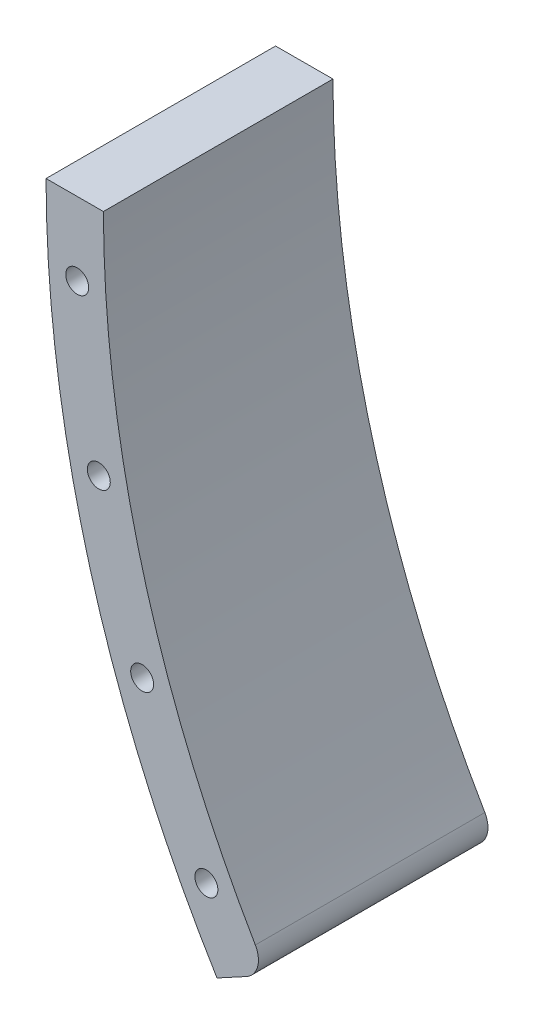
from build123d import *

# Parameters (mm, degrees)
SKETCH1_R           = 2
BOSS_EXTRUDE1_DEPTH = 40
FILLET1_R           = 4


with BuildPart() as part:
    # Sketch1 → Boss-Extrude1 (new body)
    with BuildSketch(Plane.XY):
        with BuildLine():
            Line((-123.999650399, -12.7366), (-133.999632379, -12.755584536))
            ThreePointArc((-133.999632379, -12.755584536), (-126.357727013, -67.682340192), (-104.205340418, -118.521488224))
            Line((-104.205340418, -118.521488224), (-95.406545634, -113.742234823))
            ThreePointArc((-95.406545634, -113.742234823), (-116.664774404, -65.210158377), (-123.999650399, -12.7366))
        make_face()
        with Locations((-128.565543545, -25.510785173)):
            Circle(SKETCH1_R, mode=Mode.SUBTRACT)
        with Locations((-124.80403691, -53.01786585)):
            Circle(SKETCH1_R, mode=Mode.SUBTRACT)
        with Locations((-117.250891281, -79.733748965)):
            Circle(SKETCH1_R, mode=Mode.SUBTRACT)
        with Locations((-106.053120049, -105.138440244)):
            Circle(SKETCH1_R, mode=Mode.SUBTRACT)
    extrude(amount=BOSS_EXTRUDE1_DEPTH)

    # Fillet1
    fillet1_edges = [part.edges().sort_by_distance(p)[0] for p in [
        (-95.406545634, -113.742234823, 20),
    ]]
    fillet(fillet1_edges, radius=FILLET1_R)


solid = part.part
